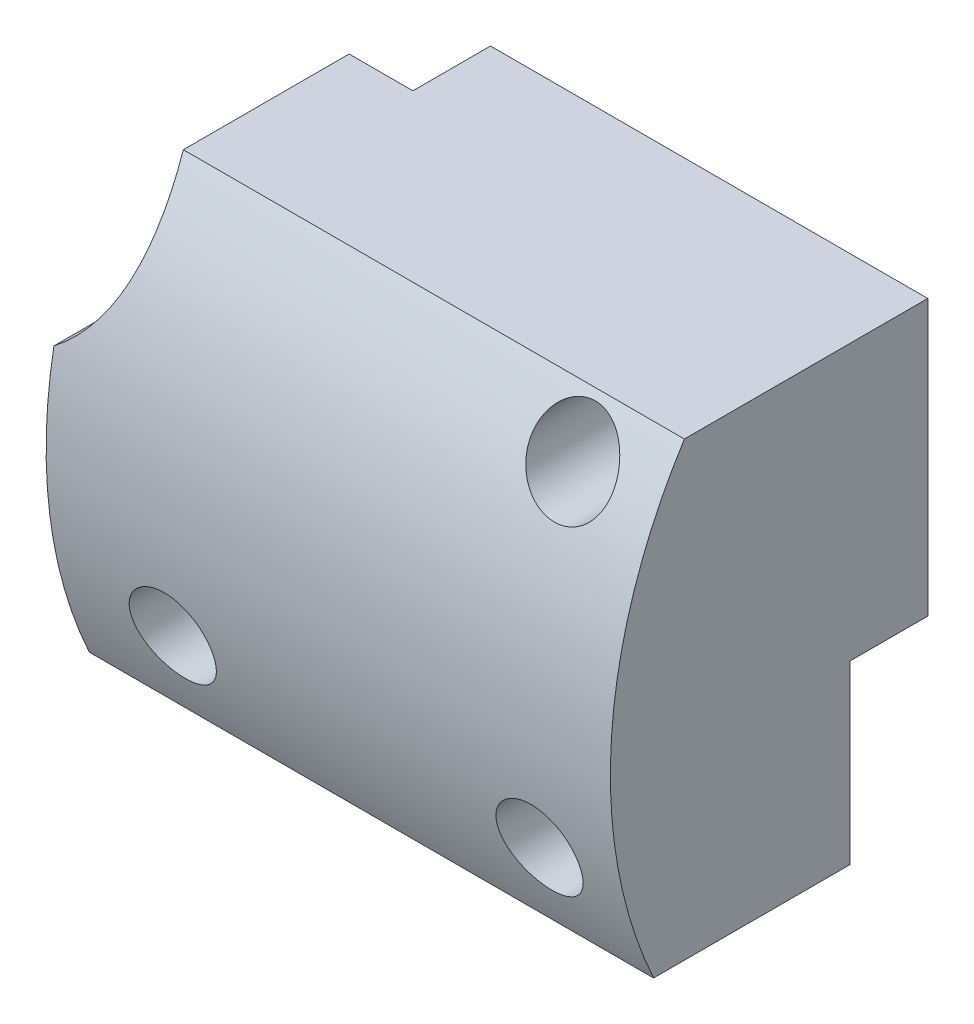
from build123d import *

# Parameters (mm, degrees)
SKETCH1_W               = 40
SKETCH1_H               = 32
BOSS_EXTRUDE1_DEPTH     = 17
SKETCH3_W               = 31
SKETCH3_H               = 19.5
BOSS_EXTRUDE2_DEPTH     = 5.5
CUT_EXTRUDE1_REACH      = 93.662
SKETCH2_R               = 1.75
CUT_EXTRUDE2_DEPTH      = 6
CUT_EXTRUDE2_DEPTH_BACK = 6
SKETCH5_R               = 2.5
CUT_EXTRUDE3_DEPTH      = 21.5
SKETCH6_R               = 11.75
CUT_EXTRUDE4_DEPTH      = 22.5
CUT_EXTRUDE5_DEPTH      = 7
CUT_EXTRUDE5_DEPTH_BACK = 7
SKETCH9_R               = 3
CUT_EXTRUDE7_DEPTH      = 13
SKETCH10_R              = 3
CUT_EXTRUDE8_DEPTH      = 18.5
CUT_EXTRUDE6_REACH      = 79.599


with BuildPart() as part:
    # Sketch1 → Boss-Extrude1 (new body)
    with BuildSketch(Plane.XY):
        with Locations((-41.344294363, 48.285102326)):
            Rectangle(SKETCH1_W, SKETCH1_H)
    extrude(amount=BOSS_EXTRUDE1_DEPTH)

    # Sketch3 → Boss-Extrude2 (add)
    with BuildSketch(Plane(origin=(0, 0, 0), x_dir=(-1, 0, 0), z_dir=(0, 0, -1))):
        with Locations((36.844294363, 54.535102326)):
            Rectangle(SKETCH3_W, SKETCH3_H)
    extrude(amount=BOSS_EXTRUDE2_DEPTH)

    # Cut-Extrude1: up to this face of the body (flat: up to its plane)
    cut_extrude1_end = Plane(part.part.faces().sort_by_distance((-36.844294363, 54.535102326, -5.5))[0])
    # Sketch2 → Cut-Extrude1 (cut, up to the picked face)
    with BuildSketch(Plane.XY.offset(17), mode=Mode.PRIVATE) as cut_extrude1_sk1:
        with Locations((-27.344294363, 60.785102326)):
            Circle(SKETCH2_R)
    cut_extrude1_tool1 = split(extrude(cut_extrude1_sk1.sketch, amount=-CUT_EXTRUDE1_REACH, mode=Mode.PRIVATE), bisect_by=cut_extrude1_end, keep=Keep.BOTH, mode=Mode.PRIVATE)
    # Sketch2 → Cut-Extrude1 (cut, up to the picked face)
    with BuildSketch(Plane.XY.offset(17), mode=Mode.PRIVATE) as cut_extrude1_sk2:
        with Locations((-27.344294363, 38.285102326)):
            Circle(SKETCH2_R)
    cut_extrude1_tool2 = split(extrude(cut_extrude1_sk2.sketch, amount=-CUT_EXTRUDE1_REACH, mode=Mode.PRIVATE), bisect_by=cut_extrude1_end, keep=Keep.BOTH, mode=Mode.PRIVATE)
    # Sketch2 → Cut-Extrude1 (cut, up to the picked face)
    with BuildSketch(Plane.XY.offset(17), mode=Mode.PRIVATE) as cut_extrude1_sk3:
        with Locations((-53.344294363, 38.285102326)):
            Circle(SKETCH2_R)
    cut_extrude1_tool3 = split(extrude(cut_extrude1_sk3.sketch, amount=-CUT_EXTRUDE1_REACH, mode=Mode.PRIVATE), bisect_by=cut_extrude1_end, keep=Keep.BOTH, mode=Mode.PRIVATE)
    add(cut_extrude1_tool1.solids().sort_by(Axis((-27.344294, 60.785102, 17), (0, 0, -1)))[0], mode=Mode.SUBTRACT)
    add(cut_extrude1_tool2.solids().sort_by(Axis((-27.344294, 38.285102, 17), (0, 0, -1)))[0], mode=Mode.SUBTRACT)
    add(cut_extrude1_tool3.solids().sort_by(Axis((-53.344294, 38.285102, 17), (0, 0, -1)))[0], mode=Mode.SUBTRACT)

    # Sketch4 → Cut-Extrude2 (cut, two sides: drawn at the far end of the back side and taken through both)
    with BuildSketch(Plane(origin=(-40.344294363, 0, 0), x_dir=(0, 0, -1), z_dir=(1, 0, 0)).offset(-CUT_EXTRUDE2_DEPTH_BACK)):
        with BuildLine():
            Line((0.5, 57.284133416), (11.5, 57.284133416))
            Line((11.5, 57.284133416), (11.5, 46.284133416))
            ThreePointArc((11.5, 46.284133416), (-7.278174593, 38.505958823), (0.5, 57.284133416))
        make_face()
    extrude(amount=CUT_EXTRUDE2_DEPTH + CUT_EXTRUDE2_DEPTH_BACK, mode=Mode.SUBTRACT)

    # Sketch5 → Cut-Extrude3 (cut)
    with BuildSketch(Plane(origin=(0, 0, -5.5), x_dir=(-1, 0, 0), z_dir=(0, 0, -1))):
        with Locations((40.344294363, 46.284133416)):
            Circle(SKETCH5_R)
    extrude(amount=-CUT_EXTRUDE3_DEPTH, mode=Mode.SUBTRACT)

    # Sketch6 → Cut-Extrude4 (cut)
    with BuildSketch(Plane.XY.offset(17)):
        with Locations((-68.344294363, 61.785102326)):
            Circle(SKETCH6_R)
    extrude(amount=-CUT_EXTRUDE4_DEPTH, mode=Mode.SUBTRACT)

    # Sketch7 → Cut-Extrude5 (cut, two sides: drawn at the far end of the back side and taken through both)
    with BuildSketch(Plane(origin=(-40.344294363, 0, 0), x_dir=(0, 0, -1), z_dir=(1, 0, 0)).offset(-CUT_EXTRUDE5_DEPTH_BACK)):
        with BuildLine():
            Line((0.5, 50.784133416), (3.5, 50.784133416))
            ThreePointArc((3.5, 50.784133416), (8, 46.284133416), (3.5, 41.784133416))
            Line((3.5, 41.784133416), (0.5, 41.784133416))
            ThreePointArc((0.5, 41.784133416), (-4, 46.284133416), (0.5, 50.784133416))
        make_face()
    extrude(amount=CUT_EXTRUDE5_DEPTH + CUT_EXTRUDE5_DEPTH_BACK, mode=Mode.SUBTRACT)

    # Sketch9 → Cut-Extrude7 (cut)
    with BuildSketch(Plane.XY.offset(17)):
        with Locations((-27.344294363, 38.285102326)):
            Circle(SKETCH9_R)
        with Locations((-53.344294363, 38.285102326)):
            Circle(SKETCH9_R)
    extrude(amount=-CUT_EXTRUDE7_DEPTH, mode=Mode.SUBTRACT)

    # Sketch10 → Cut-Extrude8 (cut)
    with BuildSketch(Plane.XY.offset(17)):
        with Locations((-27.344294363, 60.785102326)):
            Circle(SKETCH10_R)
    extrude(amount=-CUT_EXTRUDE8_DEPTH, mode=Mode.SUBTRACT)

    # Cut-Extrude6: up to this face of the body (flat: up to its plane)
    cut_extrude6_end = Plane(part.part.faces().sort_by_distance((-61.344294363, 42.316455804, 8.5))[0])
    # Sketch8 → Cut-Extrude6 (cut, up to the picked face)
    with BuildSketch(Plane(origin=(-21.344294363, 0, 0), x_dir=(0, 0, -1), z_dir=(1, 0, 0)), mode=Mode.PRIVATE) as cut_extrude6_sk1:
        with BuildLine():
            Line((-9.261769408, 67.698643379), (-19.68345764, 67.698643379))
            Line((-19.68345764, 67.698643379), (-19.68345764, 31.088127449))
            Line((-19.68345764, 31.088127449), (-13.3551738, 31.088127449))
            ThreePointArc((-13.3551738, 31.088127449), (-16.792545144, 50.006557071), (-9.261769408, 67.698643379))
        make_face()
    cut_extrude6_tool1 = split(extrude(cut_extrude6_sk1.sketch, amount=-CUT_EXTRUDE6_REACH, mode=Mode.PRIVATE), bisect_by=cut_extrude6_end, keep=Keep.BOTH, mode=Mode.PRIVATE)
    add(cut_extrude6_tool1.solids().sort_by(Axis((-21.344294, 51.901758, 16.96141), (-1, 0, 0)))[0], mode=Mode.SUBTRACT)


solid = part.part
